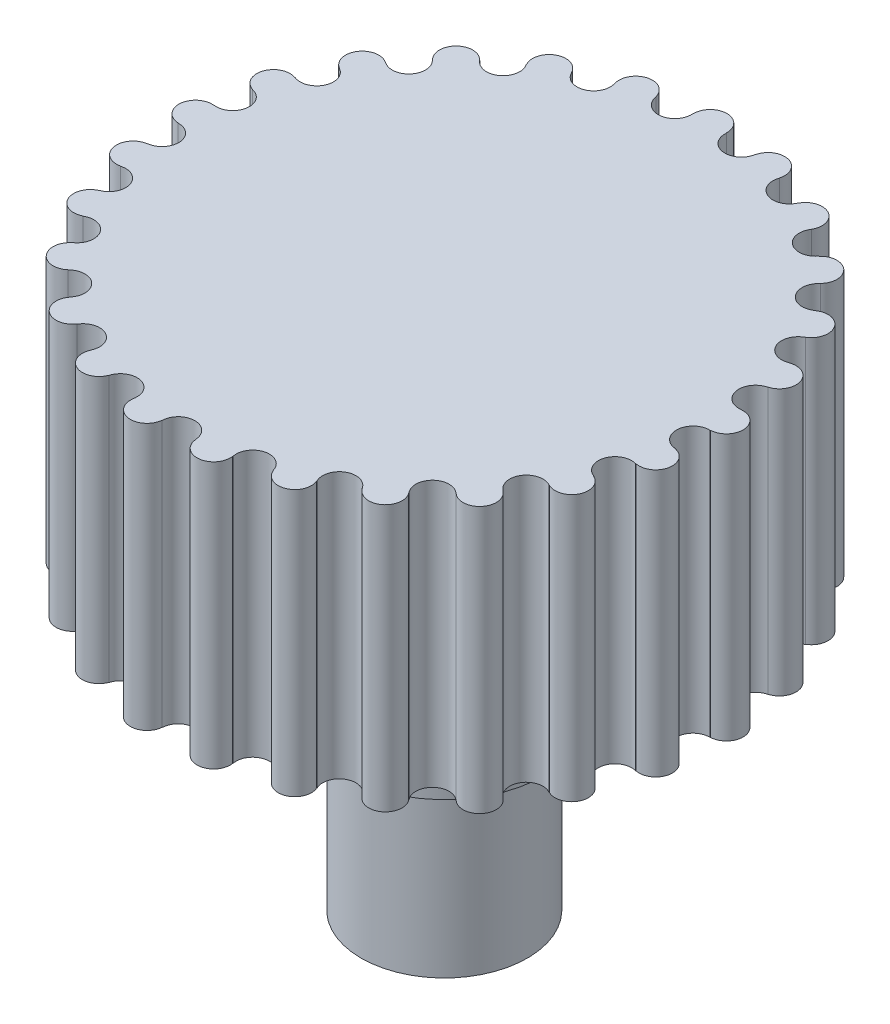
from build123d import *

# Parameters (mm, degrees)
SKETCH_1_R          = 2.5
EXTRUDE_1_DEPTH     = 6
SKETCH_2_R          = 3
EXTRUDE_2_DEPTH     = 1
SKETCH_3_R          = 2.5
EXTRUDE_3_DEPTH     = 2.5
SKETCH_4_R          = 8
EXTRUDE_4_DEPTH     = 8
SKETCH_6_R          = 0.5
EXTRUDE_5_DEPTH     = 8
SKETCH_7_R          = 0.5
CUT_EXTRUDE_1_DEPTH = 8
CUT_EXTRUDE_2_DEPTH = 1.5


with BuildPart() as part:
    # 草图1 → 凸台-拉伸1 (new body)
    with BuildSketch(Plane(origin=(0, 0, 0), x_dir=(1, 0, 0), z_dir=(0, 1, 0))):
        with Locations(Location((0, 0, 0), (0, 0, 270))):
            Circle(SKETCH_1_R)
    extrude(amount=EXTRUDE_1_DEPTH)

    # 草图2 → 凸台-拉伸2 (add)
    with BuildSketch(Plane(origin=(0, 6, 0), x_dir=(1, 0, 0), z_dir=(0, 1, 0))):
        with Locations(Location((0, 0, 0), (0, 0, 270))):
            Circle(SKETCH_2_R)
    extrude(amount=-EXTRUDE_2_DEPTH)

    # 草图3 → 凸台-拉伸3 (add)
    with BuildSketch(Plane(origin=(0, 6, 0), x_dir=(1, 0, 0), z_dir=(0, 1, 0))):
        with Locations(Location((0, 0, 0), (0, 0, 270))):
            Circle(SKETCH_3_R)
    extrude(amount=EXTRUDE_3_DEPTH)

    # 草图4 → 凸台-拉伸4 (add)
    with BuildSketch(Plane(origin=(0, 8.5, 0), x_dir=(1, 0, 0), z_dir=(0, 1, 0))):
        with Locations(Location((0, 0, 0), (0, 0, 270))):
            Circle(SKETCH_4_R)
    extrude(amount=EXTRUDE_4_DEPTH)

    # 草图6 → 凸台-拉伸5 (add)
    with BuildSketch(Plane(origin=(0, 16.5, 0), x_dir=(1, 0, 0), z_dir=(0, 1, 0))):
        with Locations((0, 8)):
            Circle(SKETCH_6_R)
        with Locations((1.989519097, 7.748665289)):
            Circle(SKETCH_6_R)
        with Locations((3.854029393, 7.01045344)):
            Circle(SKETCH_6_R)
        with Locations((5.476376847, 5.831749019)):
            Circle(SKETCH_6_R)
        with Locations((6.754623404, 4.28661436)):
            Circle(SKETCH_6_R)
        with Locations((7.60845213, 2.472135955)):
            Circle(SKETCH_6_R)
        with Locations((7.984213827, 0.502324156)):
            Circle(SKETCH_6_R)
        with Locations((7.858298006, -1.499050517)):
            Circle(SKETCH_6_R)
        with Locations((7.23861642, -3.406234333)):
            Circle(SKETCH_6_R)
        with Locations((6.164105942, -5.099391918)):
            Circle(SKETCH_6_R)
        with Locations((4.702282018, -6.472135955)):
            Circle(SKETCH_6_R)
        with Locations((2.944996421, -7.438211887)):
            Circle(SKETCH_6_R)
        with Locations((1.002665869, -7.936917611)):
            Circle(SKETCH_6_R)
        with Locations((-1.002665869, -7.936917611)):
            Circle(SKETCH_6_R)
        with Locations((-2.944996421, -7.438211887)):
            Circle(SKETCH_6_R)
        with Locations((-4.702282018, -6.472135955)):
            Circle(SKETCH_6_R)
        with Locations((-6.164105942, -5.099391918)):
            Circle(SKETCH_6_R)
        with Locations((-7.23861642, -3.406234333)):
            Circle(SKETCH_6_R)
        with Locations((-7.858298006, -1.499050517)):
            Circle(SKETCH_6_R)
        with Locations((-7.984213827, 0.502324156)):
            Circle(SKETCH_6_R)
        with Locations((-7.60845213, 2.472135955)):
            Circle(SKETCH_6_R)
        with Locations((-6.754623404, 4.28661436)):
            Circle(SKETCH_6_R)
        with Locations((-5.476376847, 5.831749019)):
            Circle(SKETCH_6_R)
        with Locations((-3.854029393, 7.01045344)):
            Circle(SKETCH_6_R)
        with Locations((-1.989519097, 7.748665289)):
            Circle(SKETCH_6_R)
    extrude(amount=-EXTRUDE_5_DEPTH)

    # 草图7 → 切除-拉伸1 (cut)
    with BuildSketch(Plane(origin=(0, 16.5, 0), x_dir=(1, 0, 0), z_dir=(0, 1, 0))):
        with Locations((1.002665869, 7.936917611)):
            Circle(SKETCH_7_R)
        with Locations((2.944996421, 7.438211887)):
            Circle(SKETCH_7_R)
        with Locations((4.702282018, 6.472135955)):
            Circle(SKETCH_7_R)
        with Locations((6.164105942, 5.099391918)):
            Circle(SKETCH_7_R)
        with Locations((7.23861642, 3.406234333)):
            Circle(SKETCH_7_R)
        with Locations((7.858298006, 1.499050517)):
            Circle(SKETCH_7_R)
        with Locations((7.984213827, -0.502324156)):
            Circle(SKETCH_7_R)
        with Locations((7.60845213, -2.472135955)):
            Circle(SKETCH_7_R)
        with Locations((6.754623404, -4.28661436)):
            Circle(SKETCH_7_R)
        with Locations((5.476376847, -5.831749019)):
            Circle(SKETCH_7_R)
        with Locations((3.854029393, -7.01045344)):
            Circle(SKETCH_7_R)
        with Locations((1.989519097, -7.748665289)):
            Circle(SKETCH_7_R)
        with Locations((0, -8)):
            Circle(SKETCH_7_R)
        with Locations((-1.989519097, -7.748665289)):
            Circle(SKETCH_7_R)
        with Locations((-3.854029393, -7.01045344)):
            Circle(SKETCH_7_R)
        with Locations((-5.476376847, -5.831749019)):
            Circle(SKETCH_7_R)
        with Locations((-6.754623404, -4.28661436)):
            Circle(SKETCH_7_R)
        with Locations((-7.60845213, -2.472135955)):
            Circle(SKETCH_7_R)
        with Locations((-7.984213827, -0.502324156)):
            Circle(SKETCH_7_R)
        with Locations((-7.858298006, 1.499050517)):
            Circle(SKETCH_7_R)
        with Locations((-7.23861642, 3.406234333)):
            Circle(SKETCH_7_R)
        with Locations((-6.164105942, 5.099391918)):
            Circle(SKETCH_7_R)
        with Locations((-4.702282018, 6.472135955)):
            Circle(SKETCH_7_R)
        with Locations((-2.944996421, 7.438211887)):
            Circle(SKETCH_7_R)
        with Locations((-1.002665869, 7.936917611)):
            Circle(SKETCH_7_R)
    extrude(amount=-CUT_EXTRUDE_1_DEPTH, mode=Mode.SUBTRACT)

    # 草图9 → 切除-拉伸2 (cut)
    with BuildSketch(Plane.XZ):
        with BuildLine():
            Line((-0.844097151, 1.3), (0.844097151, 1.3))
            ThreePointArc((0.844097151, 1.3), (1.55, 0), (0.844097151, -1.3))
            Line((0.844097151, -1.3), (-0.844097151, -1.3))
            ThreePointArc((-0.844097151, -1.3), (-1.55, 0), (-0.844097151, 1.3))
        make_face()
    extrude(amount=-CUT_EXTRUDE_2_DEPTH, mode=Mode.SUBTRACT)


solid = part.part
